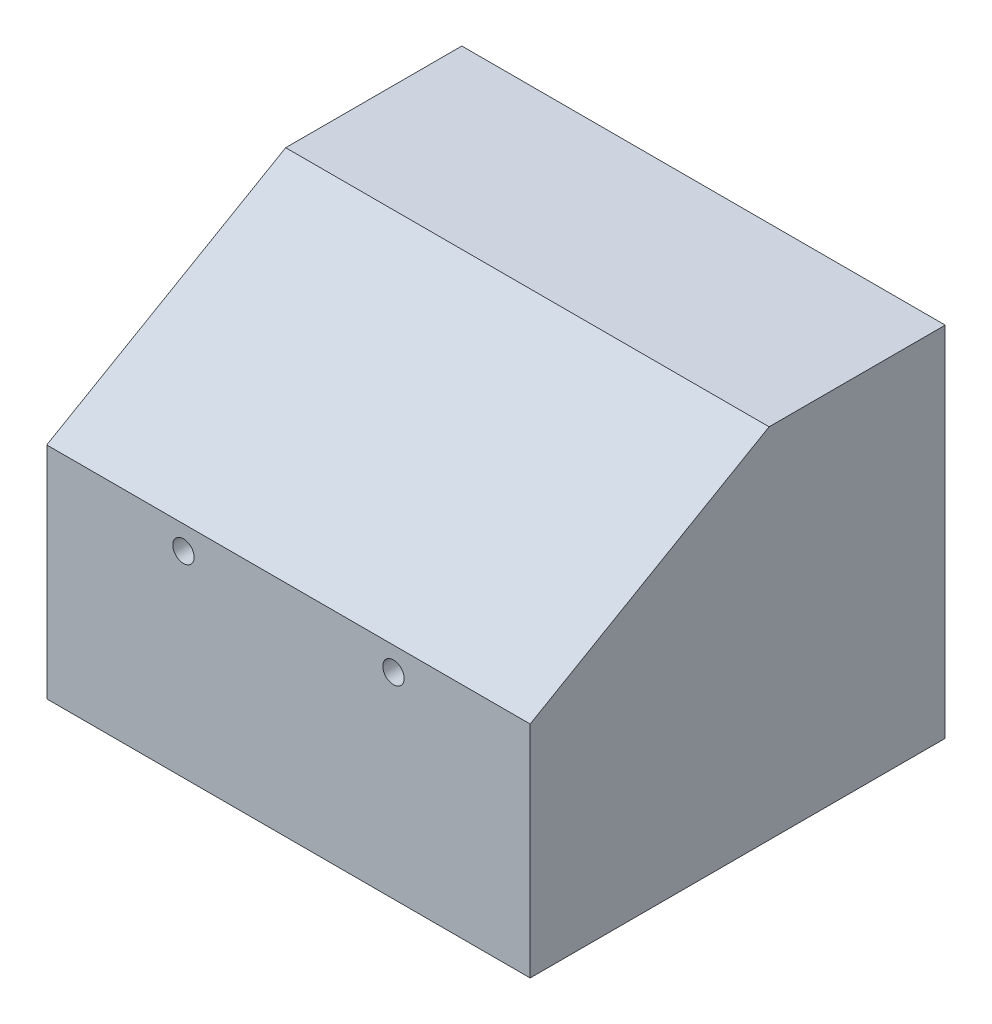
from build123d import *

# Parameters (mm, degrees)
SKIZZE2_W                                           = 194.5
SKIZZE2_H                                           = 144
AUFSATZ_LINEAR_AUSTRAGEN1_DEPTH                     = 167
STIRNSENKUNG_F_R_M4_SENKSCHRAUBE_KOPF_B_D           = 4.5
STIRNSENKUNG_F_R_M4_SENKSCHRAUBE_KOPF_B_CBORE_D     = 8.6
STIRNSENKUNG_F_R_M4_SENKSCHRAUBE_KOPF_B_CBORE_DEPTH = 162
SCHNITT_LINEAR_AUSTRAGEN1_DEPTH                     = 267.27664186


with BuildPart() as part:
    # Skizze2 → Aufsatz-Linear austragen1 (new body)
    with BuildSketch(Plane.XY):
        Rectangle(SKIZZE2_W, SKIZZE2_H)
    extrude(amount=AUFSATZ_LINEAR_AUSTRAGEN1_DEPTH)

    # Stirnsenkung für M4 Senkschraube (Kopf Button)1 (through all)
    with Locations(Plane.XY.offset(167)):
        with Locations((-42.25, 7)):
            stirnsenkung_f_r_m4_senkschraube_kopf_b = CounterBoreHole(STIRNSENKUNG_F_R_M4_SENKSCHRAUBE_KOPF_B_D / 2, STIRNSENKUNG_F_R_M4_SENKSCHRAUBE_KOPF_B_CBORE_D / 2, STIRNSENKUNG_F_R_M4_SENKSCHRAUBE_KOPF_B_CBORE_DEPTH)

    # Spiegeln1: Stirnsenkung für M4 Senkschraube (Kopf Button)1 across plane
    add(stirnsenkung_f_r_m4_senkschraube_kopf_b.mirror(Plane(origin=(0, 0, 0), x_dir=(0, 0, 1), z_dir=(1, 0, 0))), mode=Mode.SUBTRACT)

    # Skizze6 → Schnitt-Linear austragen1 (cut, through all)
    with BuildSketch(Plane.ZY.offset(97.25)):
        Polygon((70.87118018, 72), (167, 16.5), (205.188147907, 84.754255682), (82.593849392, 116.819294381), align=None)
    extrude(amount=-SCHNITT_LINEAR_AUSTRAGEN1_DEPTH, mode=Mode.SUBTRACT)


solid = part.part
